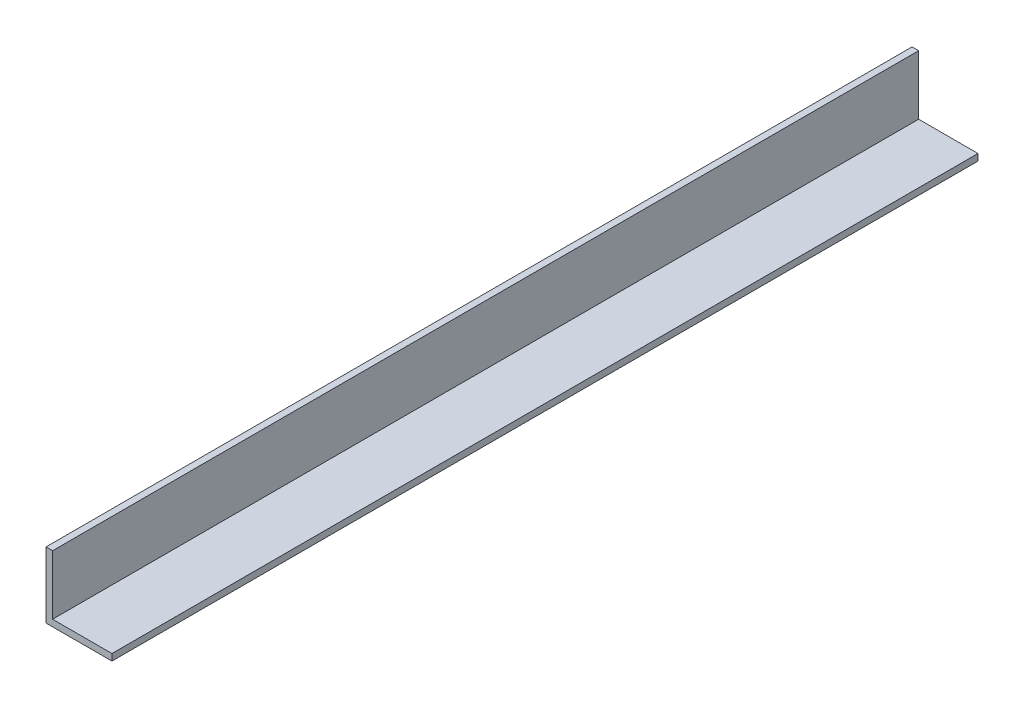
from build123d import *

# Parameters (mm, degrees)
ESTRUSIONE_ESTRUSIONE1_DEPTH = 394


with BuildPart() as part:
    # Schizzo1 → Estrusione-Estrusione1 (new body)
    with BuildSketch(Plane.XY):
        Polygon((0, 30), (0, 0), (30, 0), (30, 3), (3, 3), (3, 30), align=None)
    extrude(amount=ESTRUSIONE_ESTRUSIONE1_DEPTH)


solid = part.part
